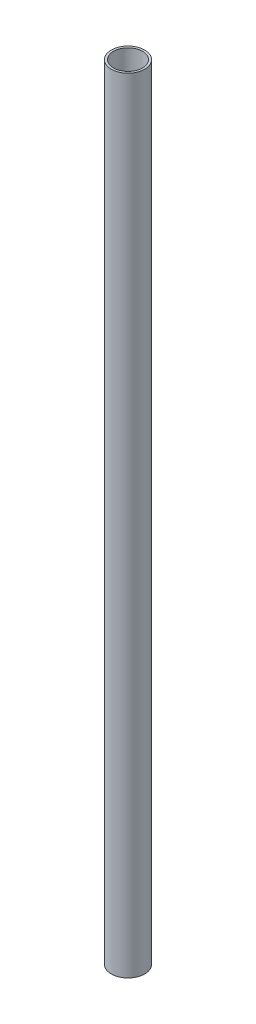
from build123d import *

# Parameters (mm, degrees)
SKETCH1_R           = 10.668
SKETCH1_R_2         = 9.271
BOSS_EXTRUDE1_DEPTH = 501.65


with BuildPart() as part:
    # Sketch1 → Boss-Extrude1 (new body)
    with BuildSketch(Plane(origin=(0, 0, 0), x_dir=(1, 0, 0), z_dir=(0, 1, 0))):
        with Locations(Location((0, 0, 0), (0, 0, 270))):
            Circle(SKETCH1_R)
        with Locations(Location((0, 0, 0), (0, 0, 270))):
            Circle(SKETCH1_R_2, mode=Mode.SUBTRACT)
    extrude(amount=BOSS_EXTRUDE1_DEPTH)


solid = part.part
